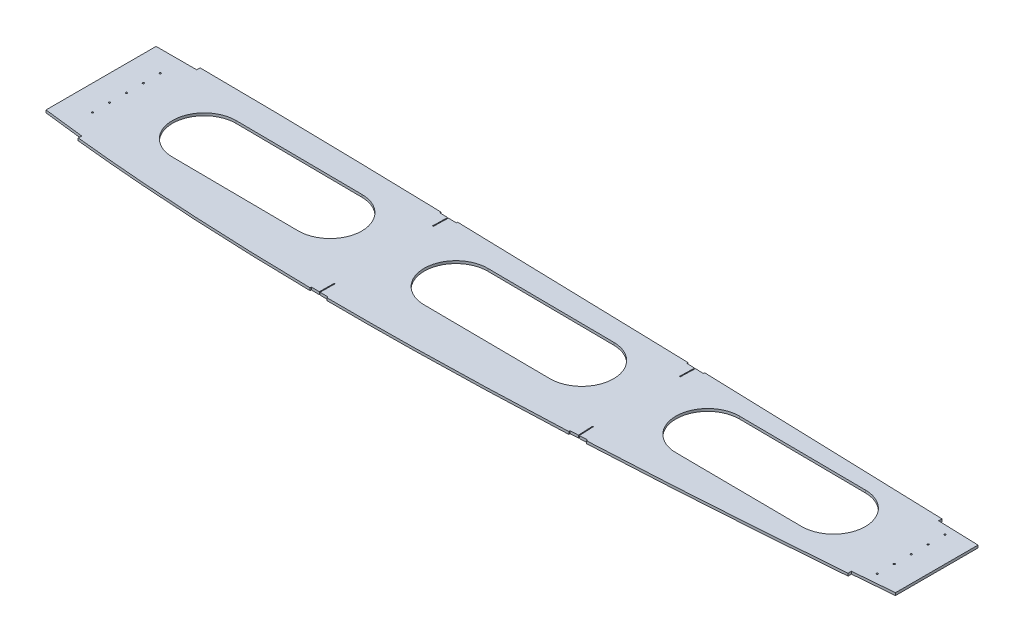
from build123d import *

# Parameters (mm, degrees)
BOSS_EXTRUDE1_DEPTH   = 6
F_4_0MM_DOWEL_HOLE1_D = 4
F_4_0MM_DOWEL_HOLE2_D = 4


with BuildPart() as part:
    # Sketch1 → Boss-Extrude1 (new body)
    with BuildSketch(Plane(origin=(0, 0, 0), x_dir=(1, 0, 0), z_dir=(0, 1, 0))):
        with BuildLine():
            Line((2499.703486599, -171.073776325), (2596, -162.925319615))
            Line((2596, -162.925319615), (2596, -65.415893177))
            Line((2596, -65.415893177), (2424.991970984, -63.971373722))
            ThreePointArc((2424.991970984, -63.971373722), (2402.577804859, -116.816939936), (2349.361137771, -138.3351893))
            Line((2349.361137771, -138.3351893), (2049.371840186, -135.801154032))
            ThreePointArc((2049.371840186, -135.801154032), (1996.526273972, -113.386987906), (1975.008024607, -60.170320818))
            Line((1975.008024607, -60.170320818), (1824.991970984, -58.903122375))
            ThreePointArc((1824.991970984, -58.903122375), (1802.577804859, -111.74868859), (1749.361137771, -133.266937954))
            Line((1749.361137771, -133.266937954), (1449.371840186, -130.732902685))
            ThreePointArc((1449.371840186, -130.732902685), (1396.526273972, -108.31873656), (1375.008024607, -55.102069472))
            Line((1375.008024607, -55.102069472), (1224.991970984, -53.834871029))
            ThreePointArc((1224.991970984, -53.834871029), (1202.577804859, -106.680437244), (1149.361137771, -128.198686608))
            Line((1149.361137771, -128.198686608), (849.371840186, -125.664651339))
            ThreePointArc((849.371840186, -125.664651339), (796.526273972, -103.250485214), (775.008024607, -50.033818126))
            Line((775.008024607, -50.033818126), (603.999995592, -48.58929867))
            Line((603.999995592, -48.58929867), (603.999995592, -178.649131079))
            Line((603.999995592, -178.649131079), (700.169555672, -189.82522818))
            Line((700.169555672, -189.82522818), (699.325355788, -197.780561394))
            add(Edge.make_bspline(
                [(1279.993726967, -230.586145743), (1251.992845438, -230.214377978), (1156.643871099, -228.426153503), (993.973907449, -222.123757287), (828.430766092, -210.545808412), (730.308385941, -201.068402366), (699.325355788, -197.780561394)],
                knots=[0.338165656, 0.338165656, 0.338165656, 0.338165656, 0.348560819, 0.373566506, 0.398590699, 0.410156143, 0.410156143, 0.410156143, 0.410156143], degree=3))
            Line((1279.993726967, -230.586145743), (1280.033554464, -227.586410126))
            Line((1280.033554464, -227.586410126), (1299.031880037, -227.838650935))
            Line((1299.031880037, -227.838650935), (1299.496534159, -192.841735406))
            Line((1299.496534159, -192.841735406), (1301.496357904, -192.86828707))
            Line((1301.496357904, -192.86828707), (1301.031703781, -227.865202599))
            Line((1301.031703781, -227.865202599), (1320.030029354, -228.117443409))
            Line((1320.030029354, -228.117443409), (1320.006426802, -231.014189882))
            add(Edge.make_bspline(
                [(1880.017536915, -218.975094986), (1786.718289466, -223.252626978), (1600.105449253, -230.003314719), (1413.337833656, -231.774649729), (1320.006426802, -231.014189882)],
                knots=[0.263896993, 0.263896993, 0.263896993, 0.263896993, 0.298568064, 0.333214348, 0.333214348, 0.333214348, 0.333214348], degree=3))
            Line((1880.017536915, -218.975094986), (1879.880138913, -215.978243006))
            Line((1879.880138913, -215.978243006), (1898.859006014, -215.082361576))
            Line((1898.859006014, -215.082361576), (1897.208698115, -180.121290599))
            Line((1897.208698115, -180.121290599), (1899.2064736, -180.02698729))
            Line((1899.2064736, -180.02698729), (1900.856781499, -214.988058267))
            Line((1900.856781499, -214.988058267), (1919.8356486, -214.092176836))
            Line((1919.8356486, -214.092176836), (1919.981085174, -217.088649463))
            add(Edge.make_bspline(
                [(2500.358506516, -179.046915538), (2467.819448595, -181.720107419), (2301.688178219, -194.916310103), (2108.203569807, -207.523423052), (1947.177539067, -215.76864439), (1919.981085174, -217.088649463)],
                knots=[0.186972113, 0.186972113, 0.186972113, 0.186972113, 0.199092181, 0.248838609, 0.258946381, 0.258946381, 0.258946381, 0.258946381], degree=3))
            Line((2500.358506516, -179.046915538), (2499.703486599, -171.073776325))
        make_face()
        with BuildLine():
            Line((2499.792273349, 35.207087267), (2500.052462016, 43.202855013))
            add(Edge.make_bspline(
                [(1919.991369728, 61.760722375), (1946.141292077, 60.986188213), (2105.246296635, 56.201656656), (2298.592719455, 49.780680894), (2465.794842369, 44.317625311), (2500.052462016, 43.202855013)],
                knots=[0.742494138, 0.742494138, 0.742494138, 0.742494138, 0.752206114, 0.801585908, 0.814310206, 0.814310206, 0.814310206, 0.814310206], degree=3))
            Line((1919.991369728, 61.760722375), (1919.903226355, 58.762017531))
            Line((1919.903226355, 58.762017531), (1900.911429005, 59.320258891))
            Line((1900.911429005, 59.320258891), (1899.883089657, 24.335369036))
            Line((1899.883089657, 24.335369036), (1897.883953094, 24.394131284))
            Line((1897.883953094, 24.394131284), (1898.912292442, 59.379021139))
            Line((1898.912292442, 59.379021139), (1879.920499189, 59.93726238))
            Line((1879.920499189, 59.93726238), (1880.008642561, 62.935967224))
            add(Edge.make_bspline(
                [(1319.993980998, 78.100288692), (1413.331517369, 75.731088455), (1600.006544772, 70.824745257), (1786.675707055, 65.658872993), (1880.008642561, 62.935967224)],
                knots=[0.668220223, 0.668220223, 0.668220223, 0.668220223, 0.70288135, 0.737544363, 0.737544363, 0.737544363, 0.737544363], degree=3))
            Line((1319.993980998, 78.100288692), (1319.917856082, 75.101254681))
            Line((1319.917856082, 75.101254681), (1300.923911605, 75.580914146))
            Line((1300.923911605, 75.580914146), (1300.040328379, 40.592069057))
            Line((1300.040328379, 40.592069057), (1298.040965803, 40.642559527))
            Line((1298.040965803, 40.642559527), (1298.924549029, 75.631404616))
            Line((1298.924549029, 75.631404616), (1279.930604552, 76.111064082))
            Line((1279.930604552, 76.111064082), (1280.005946886, 79.110117855))
            add(Edge.make_bspline(
                [(699.999889789, 89.613058052), (735.879488596, 89.493405625), (837.870012607, 88.671897295), (1005.865228965, 85.782705717), (1163.311518707, 82.018687941), (1254.670838845, 79.746587332), (1280.005946886, 79.110117855)],
                knots=[0.591485773, 0.591485773, 0.591485773, 0.591485773, 0.604805069, 0.629344389, 0.653862178, 0.663270358, 0.663270358, 0.663270358, 0.663270358], degree=3))
            Line((699.999889789, 89.613058052), (699.973211283, 81.613102536))
            Line((699.973211283, 81.613102536), (603.999995592, 81.470533738))
            Line((603.999995592, 81.470533738), (603.999995592, -48.58929867))
            Line((603.999995592, -48.58929867), (775.008024607, -50.033818126))
            ThreePointArc((775.008024607, -50.033818126), (797.422190733, 2.811748089), (850.638857821, 24.329997453))
            Line((850.638857821, 24.329997453), (1150.628155405, 21.795962184))
            ThreePointArc((1150.628155405, 21.795962184), (1203.47372162, -0.618203941), (1224.991970984, -53.834871029))
            Line((1224.991970984, -53.834871029), (1375.008024607, -55.102069472))
            ThreePointArc((1375.008024607, -55.102069472), (1397.422190733, -2.256503257), (1450.638857821, 19.261746107))
            Line((1450.638857821, 19.261746107), (1750.628155405, 16.727710838))
            ThreePointArc((1750.628155405, 16.727710838), (1803.47372162, -5.686455287), (1824.991970984, -58.903122375))
            Line((1824.991970984, -58.903122375), (1975.008024607, -60.170320818))
            ThreePointArc((1975.008024607, -60.170320818), (1997.422190733, -7.324754603), (2050.638857821, 14.193494761))
            Line((2050.638857821, 14.193494761), (2350.628155405, 11.659459492))
            ThreePointArc((2350.628155405, 11.659459492), (2403.47372162, -10.754706634), (2424.991970984, -63.971373722))
            Line((2424.991970984, -63.971373722), (2596, -65.415893177))
            Line((2596, -65.415893177), (2596, 32.093533261))
            Line((2596, 32.093533261), (2499.792273349, 35.207087267))
        make_face()
    extrude(amount=BOSS_EXTRUDE1_DEPTH)

    # Ø4.0mm Dowel Hole1 (through all)
    with Locations(Plane(origin=(2535.820689775, 0, 65.575730663), x_dir=(0, 0, -1), z_dir=(0, -1, 0))):
        with Locations((0, 0), (-40, 0), (-80, 0), (40, 0), (80, 0)):
            Hole(F_4_0MM_DOWEL_HOLE1_D / 2)

    # Ø4.0mm Dowel Hole2 (through all)
    with Locations(Plane(origin=(664.175101974, 0, 48.706016617), x_dir=(0, 0, -1), z_dir=(0, -1, 0))):
        with Locations((0, 0), (-80, 0), (-40, 0), (80, 0), (40, 0)):
            Hole(F_4_0MM_DOWEL_HOLE2_D / 2)


solid = part.part
